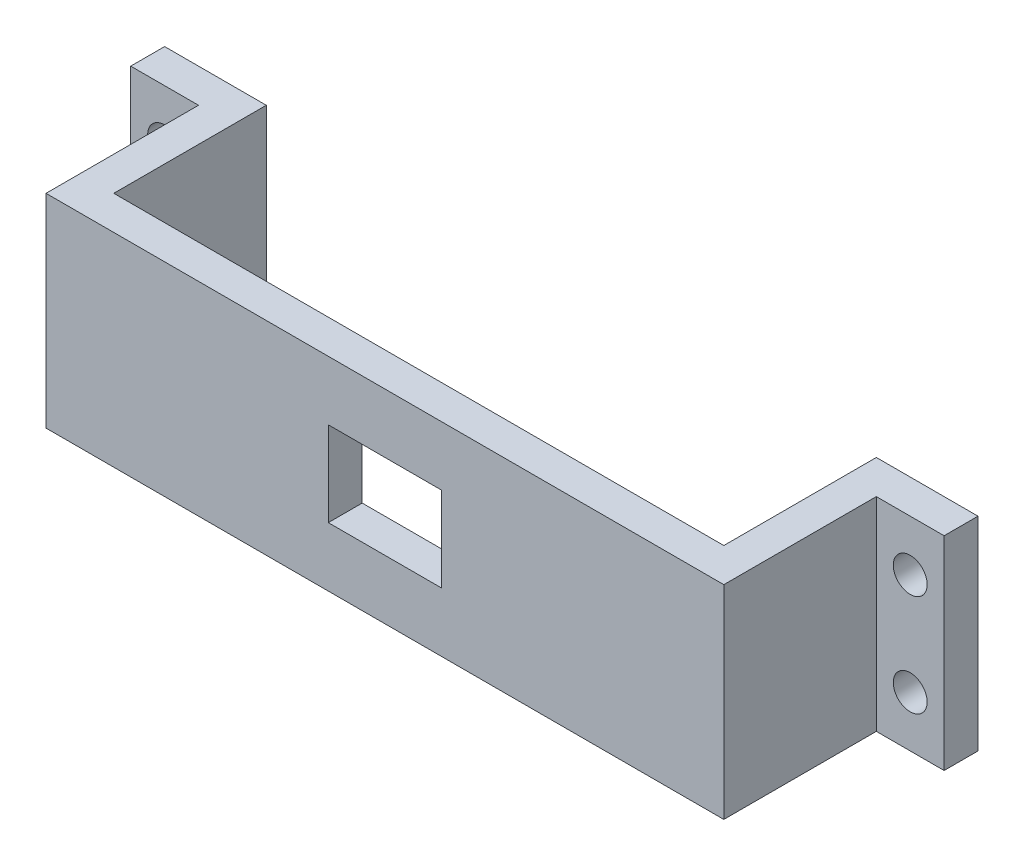
from build123d import *

# Parameters (mm, degrees)
SKETCH1_W           = 127
SKETCH1_H           = 38.1
SKETCH1_W_2         = 21.209
SKETCH1_H_2         = 15.88008
BOSS_EXTRUDE1_DEPTH = 6.35
SKETCH2_W           = 6.35
SKETCH2_H           = 38.1
BOSS_EXTRUDE2_DEPTH = 28.575
SKETCH3_W           = 6.35
SKETCH3_H           = 38.1
BOSS_EXTRUDE3_DEPTH = 12.7
SKETCH4_W           = 6.35
SKETCH4_H           = 38.1
BOSS_EXTRUDE4_DEPTH = 12.7
CUT_EXTRUDE1_REACH  = 149.595
SKETCH5_R           = 3.175


with BuildPart() as part:
    # Sketch1 → Boss-Extrude1 (new body)
    with BuildSketch(Plane.XY):
        with Locations((63.5, 19.05)):
            Rectangle(SKETCH1_W, SKETCH1_H)
        with Locations((63.5, 19.05)):
            Rectangle(SKETCH1_W_2, SKETCH1_H_2, mode=Mode.SUBTRACT)
    extrude(amount=BOSS_EXTRUDE1_DEPTH)

    # Sketch2 → Boss-Extrude2 (add)
    with BuildSketch(Plane(origin=(0, 0, 0), x_dir=(-1, 0, 0), z_dir=(0, 0, -1))):
        with Locations((-3.175, 19.05)):
            Rectangle(SKETCH2_W, SKETCH2_H)
        with Locations((-123.825, 19.05)):
            Rectangle(SKETCH2_W, SKETCH2_H)
    extrude(amount=BOSS_EXTRUDE2_DEPTH)

    # Sketch3 → Boss-Extrude3 (add)
    with BuildSketch(Plane(origin=(127, 0, 0), x_dir=(0, 0, -1), z_dir=(1, 0, 0))):
        with Locations((25.4, 19.05)):
            Rectangle(SKETCH3_W, SKETCH3_H)
    extrude(amount=BOSS_EXTRUDE3_DEPTH)

    # Sketch4 → Boss-Extrude4 (add)
    with BuildSketch(Plane.ZY):
        with Locations((-25.4, 19.05)):
            Rectangle(SKETCH4_W, SKETCH4_H)
    extrude(amount=BOSS_EXTRUDE4_DEPTH)

    # Sketch5 → Cut-Extrude1 (cut, up to next)
    with BuildSketch(Plane.XY.offset(-22.225), mode=Mode.PRIVATE) as cut_extrude1_sk1:
        with Locations((133.35, 28.575)):
            Circle(SKETCH5_R)
    cut_extrude1_tool1 = extrude(cut_extrude1_sk1.sketch, amount=-CUT_EXTRUDE1_REACH, mode=Mode.PRIVATE) & part.part
    # Sketch5 → Cut-Extrude1 (cut, up to next)
    with BuildSketch(Plane.XY.offset(-22.225), mode=Mode.PRIVATE) as cut_extrude1_sk2:
        with Locations((133.35, 9.525)):
            Circle(SKETCH5_R)
    cut_extrude1_tool2 = extrude(cut_extrude1_sk2.sketch, amount=-CUT_EXTRUDE1_REACH, mode=Mode.PRIVATE) & part.part
    # Sketch5 → Cut-Extrude1 (cut, up to next)
    with BuildSketch(Plane.XY.offset(-22.225), mode=Mode.PRIVATE) as cut_extrude1_sk3:
        with Locations((-6.35, 28.575)):
            Circle(SKETCH5_R)
    cut_extrude1_tool3 = extrude(cut_extrude1_sk3.sketch, amount=-CUT_EXTRUDE1_REACH, mode=Mode.PRIVATE) & part.part
    # Sketch5 → Cut-Extrude1 (cut, up to next)
    with BuildSketch(Plane.XY.offset(-22.225), mode=Mode.PRIVATE) as cut_extrude1_sk4:
        with Locations((-6.35, 9.525)):
            Circle(SKETCH5_R)
    cut_extrude1_tool4 = extrude(cut_extrude1_sk4.sketch, amount=-CUT_EXTRUDE1_REACH, mode=Mode.PRIVATE) & part.part
    add(cut_extrude1_tool1.solids().sort_by_distance((133.35, 28.575, -22.225))[0], mode=Mode.SUBTRACT)
    add(cut_extrude1_tool2.solids().sort_by_distance((133.35, 9.525, -22.225))[0], mode=Mode.SUBTRACT)
    add(cut_extrude1_tool3.solids().sort_by_distance((-6.35, 28.575, -22.225))[0], mode=Mode.SUBTRACT)
    add(cut_extrude1_tool4.solids().sort_by_distance((-6.35, 9.525, -22.225))[0], mode=Mode.SUBTRACT)


solid = part.part
